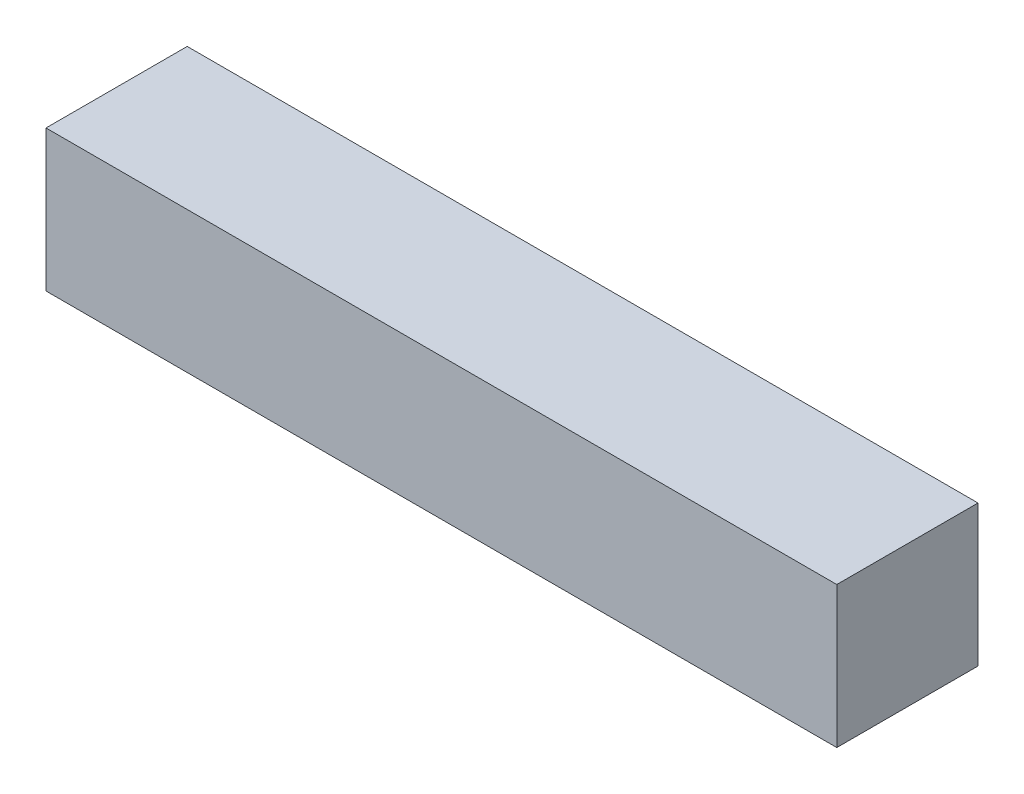
from build123d import *

# Parameters (mm, degrees)
SKETCH1_W           = 22.4
SKETCH1_H           = 4
BOSS_EXTRUDE1_DEPTH = 4


with BuildPart() as part:
    # Sketch1 → Boss-Extrude1 (new body)
    with BuildSketch(Plane(origin=(0, 0, 0), x_dir=(1, 0, 0), z_dir=(0, 1, 0))):
        Rectangle(SKETCH1_W, SKETCH1_H)
    extrude(amount=BOSS_EXTRUDE1_DEPTH)


solid = part.part
